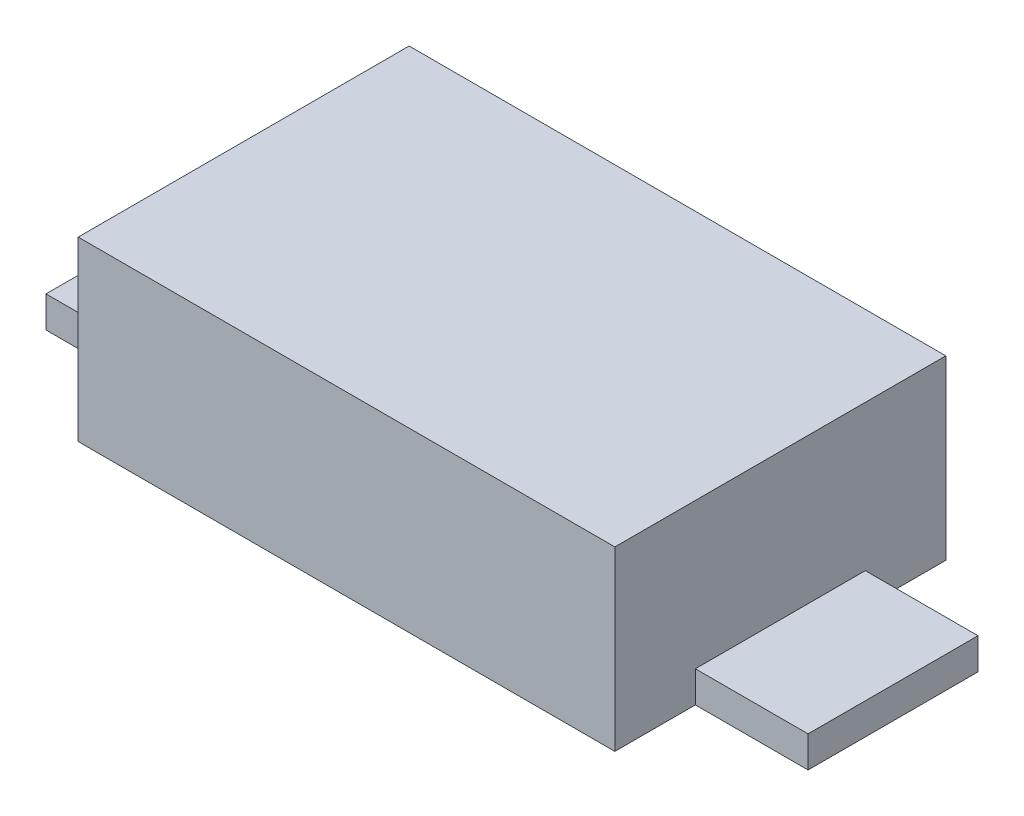
from build123d import *

# Parameters (mm, degrees)
SKETCH2_W           = 3
SKETCH2_H           = 1.85
BOSS_EXTRUDE1_DEPTH = 0.99
SKETCH3_W           = 0.63
SKETCH3_H           = 0.95
BOSS_EXTRUDE2_DEPTH = 0.175


with BuildPart() as part:
    # Sketch2 → Boss-Extrude1 (new body)
    with BuildSketch(Plane(origin=(0, 0, 0), x_dir=(1, 0, 0), z_dir=(0, 1, 0))):
        with Locations((-3.032608696, -3.207608696)):
            Rectangle(SKETCH2_W, SKETCH2_H)
    extrude(amount=BOSS_EXTRUDE1_DEPTH)

    # Sketch3 → Boss-Extrude2 (add)
    with BuildSketch(Plane(origin=(0, 0, 0), x_dir=(1, 0, 0), z_dir=(0, 1, 0))):
        with Locations((-4.847608696, -3.207608696)):
            Rectangle(SKETCH3_W, SKETCH3_H)
        with Locations((-1.217608696, -3.207608696)):
            Rectangle(SKETCH3_W, SKETCH3_H)
    extrude(amount=BOSS_EXTRUDE2_DEPTH)


solid = part.part
